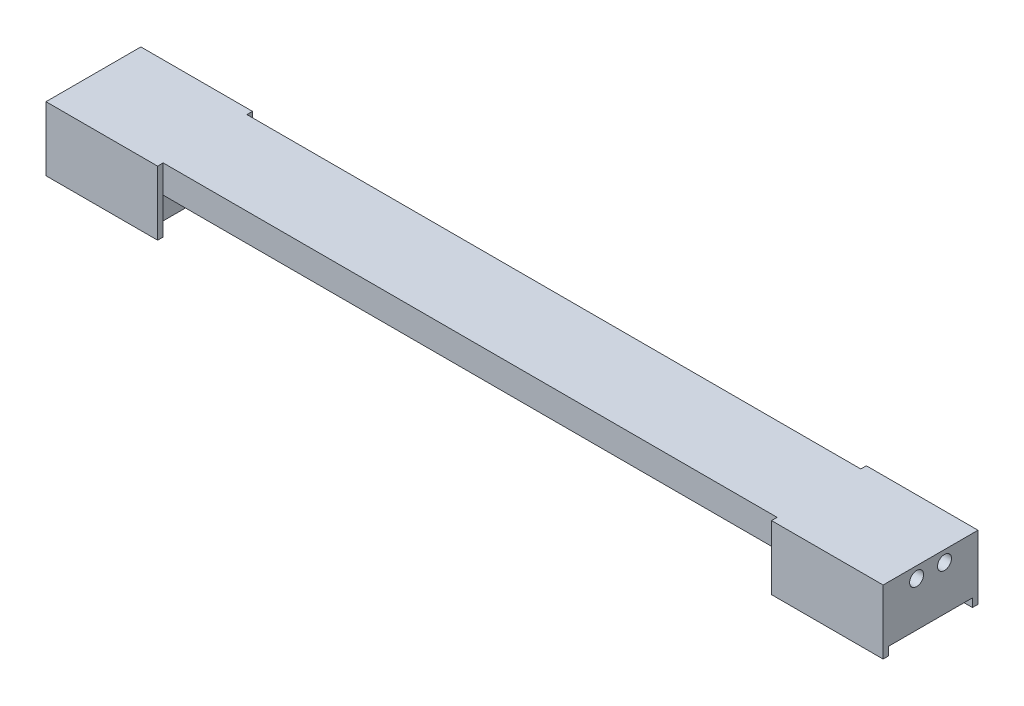
from build123d import *

# Parameters (mm, degrees)
AUFSATZ_LINEAR_AUSTRAGEN1_DEPTH             = 15
AUFSATZ_LINEAR_AUSTRAGEN4_DEPTH             = 1.5
AUFSATZ_LINEAR_AUSTRAGEN4_DIRECTION_2_REACH = 78.164
SKIZZE6_R                                   = 1.25
SKIZZE6_W                                   = 15
SKIZZE6_H                                   = 1.5
SCHNITT_LINEAR_AUSTRAGEN1_DEPTH             = 152.28863143


with BuildPart() as part:
    # Skizze1 → Aufsatz-Linear austragen1 (new body)
    with BuildSketch(Plane.XY):
        Polygon((-74, 0), (-74, -10), (-56, -10), (-56, -5), (56, -5), (56, -10), (74, -10), (74, 0), align=None)
    extrude(amount=AUFSATZ_LINEAR_AUSTRAGEN1_DEPTH)

    # Skizze5 → Aufsatz-Linear austragen4 (add)
    with BuildSketch(Plane.XZ.offset(10)):
        Polygon((56, 0), (55, 0), (55, -1), (56, -1), (75, -1), (75, 16), (56, 16), (55, 16), (55, 15), (56, 15), (74, 15), (74, 0), align=None)
    aufsatz_linear_austragen4 = extrude(amount=AUFSATZ_LINEAR_AUSTRAGEN4_DEPTH)

    # Aufsatz-Linear austragen4 direction 2: up to this face of the body (flat: up to its plane)
    aufsatz_linear_austragen4_direction_2_end = Plane(part.part.faces().sort_by_distance((0, 0, 7.5))[0])
    # Skizze5 → Aufsatz-Linear austragen4 direction 2 (add, up to the picked face)
    with BuildSketch(Plane.XZ.offset(10), mode=Mode.PRIVATE) as aufsatz_linear_austragen4_direction_2_sk1:
        Polygon((56, 0), (55, 0), (55, -1), (56, -1), (75, -1), (75, 16), (56, 16), (55, 16), (55, 15), (56, 15), (74, 15), (74, 0), align=None)
    aufsatz_linear_austragen4_direction_2_tool1 = split(extrude(aufsatz_linear_austragen4_direction_2_sk1.sketch, amount=-AUFSATZ_LINEAR_AUSTRAGEN4_DIRECTION_2_REACH, mode=Mode.PRIVATE), bisect_by=aufsatz_linear_austragen4_direction_2_end, keep=Keep.BOTH, mode=Mode.PRIVATE)
    aufsatz_linear_austragen4_direction_2 = aufsatz_linear_austragen4_direction_2_tool1.solids().sort_by(Axis((55.5, -10, -0.262488), (0, 1, 0)))[0]
    add(aufsatz_linear_austragen4_direction_2)

    # Spiegeln1: Aufsatz-Linear austragen4, Aufsatz-Linear austragen4 direction 2 across plane
    add(aufsatz_linear_austragen4.mirror(Plane(origin=(0, 0, 0), x_dir=(0, 0, 1), z_dir=(1, 0, 0))))
    add(aufsatz_linear_austragen4_direction_2.mirror(Plane(origin=(0, 0, 0), x_dir=(0, 0, 1), z_dir=(1, 0, 0))))

    # Skizze6 → Schnitt-Linear austragen1 (cut, through all)
    with BuildSketch(Plane.ZY.offset(75)):
        with Locations(Location((10, -2, 0), (0, 0, 270))):
            Circle(SKIZZE6_R)
        with Locations(Location((5, -2, 0), (0, 0, 90))):
            Circle(SKIZZE6_R)
        with Locations((7.5, -10.75)):
            Rectangle(SKIZZE6_W, SKIZZE6_H)
    extrude(amount=-SCHNITT_LINEAR_AUSTRAGEN1_DEPTH, mode=Mode.SUBTRACT)


solid = part.part
